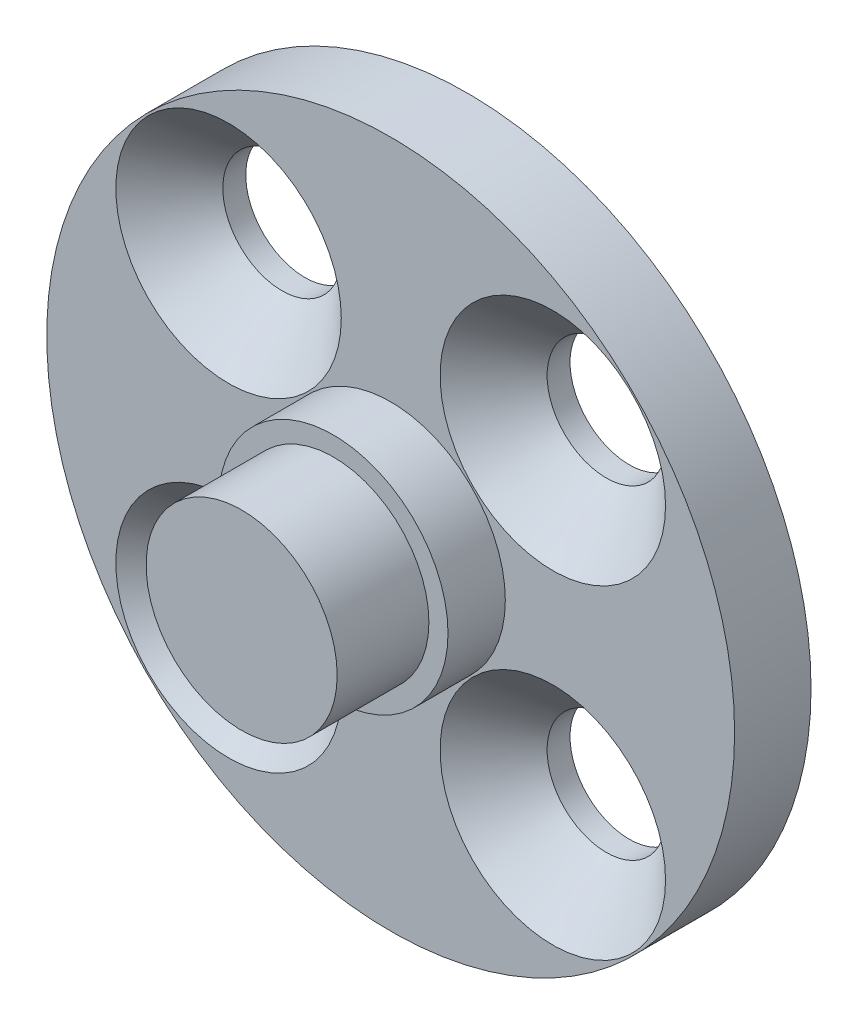
from build123d import *

# Parameters (mm, degrees)
SKETCH1_R           = 9
SKETCH1_R_2         = 1.55
BOSS_EXTRUDE1_DEPTH = 2
SKETCH2_R           = 3
BOSS_EXTRUDE2_DEPTH = 1.5
SKETCH3_R           = 2.5
BOSS_EXTRUDE3_DEPTH = 2.4
CHAMFER1_SIZE       = 1.4


with BuildPart() as part:
    # Sketch1 → Boss-Extrude1 (new body)
    with BuildSketch(Plane(origin=(0, 0, 0), x_dir=(0, 1, 0), z_dir=(0, 0, 1))):
        Circle(SKETCH1_R)
        with Locations((-4.242640687, 4.242640687)):
            Circle(SKETCH1_R_2, mode=Mode.SUBTRACT)
        with Locations((4.242640687, 4.242640687)):
            Circle(SKETCH1_R_2, mode=Mode.SUBTRACT)
        with Locations((4.242640687, -4.242640687)):
            Circle(SKETCH1_R_2, mode=Mode.SUBTRACT)
        with Locations((-4.242640687, -4.242640687)):
            Circle(SKETCH1_R_2, mode=Mode.SUBTRACT)
    extrude(amount=BOSS_EXTRUDE1_DEPTH)

    # Sketch2 → Boss-Extrude2 (add)
    with BuildSketch(Plane.XY.offset(2)):
        Circle(SKETCH2_R)
    extrude(amount=BOSS_EXTRUDE2_DEPTH)

    # Sketch3 → Boss-Extrude3 (add)
    with BuildSketch(Plane.XY.offset(3.5)):
        Circle(SKETCH3_R)
    extrude(amount=BOSS_EXTRUDE3_DEPTH)

    # Chamfer1
    chamfer1_edges = [part.edges().sort_by_distance(p)[0] for p in [
        (-4.242640687, 2.692640687, 2),
        (-4.242640687, -5.792640687, 2),
        (4.242640687, -5.792640687, 2),
        (4.242640687, 2.692640687, 2),
    ]]
    chamfer(chamfer1_edges, length=CHAMFER1_SIZE)


solid = part.part
